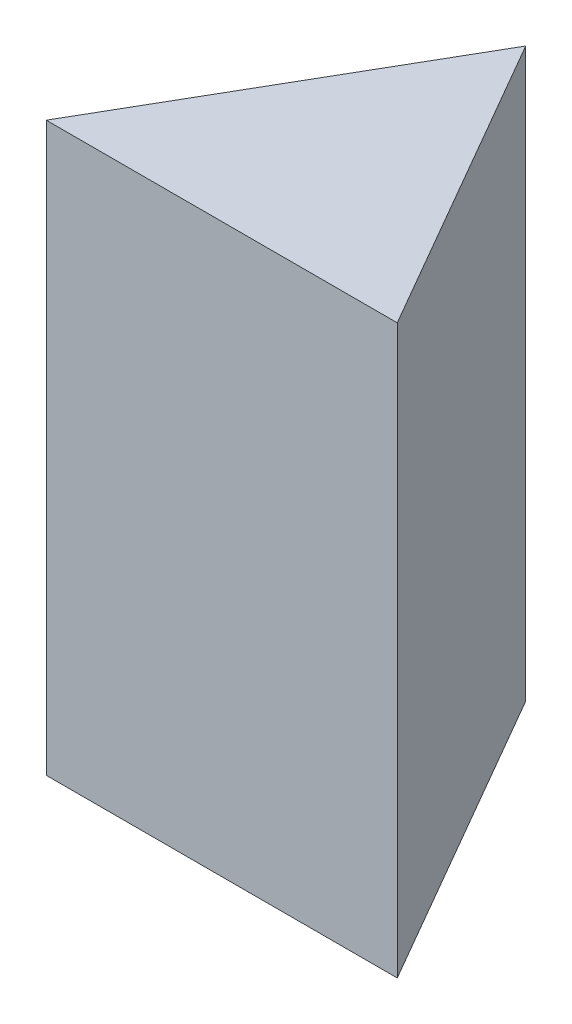
from build123d import *

# Parameters (mm, degrees)
EXTRUDE_1_DEPTH = 70
EXTRUDE_2_DEPTH = 5
EXTRUDE_3_DEPTH = 5


with BuildPart() as part:
    # 草图1 → 凸台-拉伸1 (new body)
    with BuildSketch(Plane(origin=(0, 0, 0), x_dir=(1, 0, 0), z_dir=(0, 1, 0))):
        Polygon((0, 25), (21.650635095, -12.5), (-21.650635095, -12.5), align=None)
        Polygon((-16.454482672, -9.5), (0, 19), (16.454482672, -9.5), align=None, mode=Mode.SUBTRACT)
    extrude(amount=EXTRUDE_1_DEPTH)

    # 草图2 → 凸台-拉伸2 (add)
    with BuildSketch(Plane(origin=(0, 70, 0), x_dir=(1, 0, 0), z_dir=(0, 1, 0))):
        Polygon((0, 19), (16.454482672, -9.5), (-16.454482672, -9.5), align=None)
    extrude(amount=-EXTRUDE_2_DEPTH)

    # 草图3 → 凸台-拉伸3 (add)
    with BuildSketch(Plane.XZ):
        Polygon((-16.454482672, 9.5), (16.454482672, 9.5), (0, -19), align=None)
        Polygon((0, -9), (-7.794228634, 4.5), (7.794228634, 4.5), align=None, mode=Mode.SUBTRACT)
    extrude(amount=-EXTRUDE_3_DEPTH)


solid = part.part
